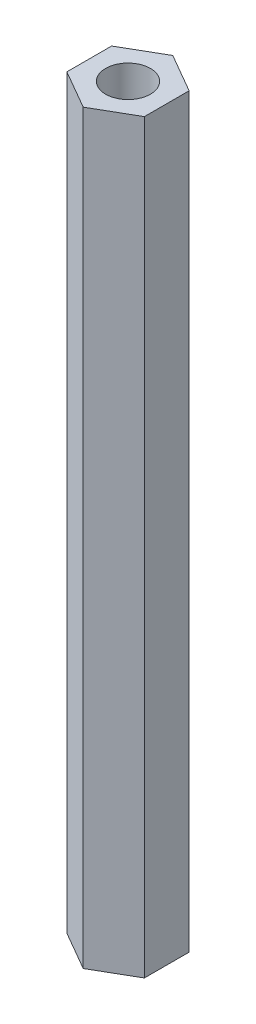
from build123d import *

# Parameters (mm, degrees)
BOSS_EXTRUDE1_DEPTH = 50
SKETCH2_R           = 1.5
CUT_EXTRUDE1_DEPTH  = 51.157252716


with BuildPart() as part:
    # Sketch1 → Boss-Extrude1 (new body)
    with BuildSketch(Plane(origin=(0, 0, 0), x_dir=(1, 0, 0), z_dir=(0, 1, 0))):
        Polygon((0, -3), (2.598076211, -1.5), (2.598076211, 1.5), (0, 3), (-2.598076211, 1.5), (-2.598076211, -1.5), align=None)
    extrude(amount=BOSS_EXTRUDE1_DEPTH)

    # Sketch2 → Cut-Extrude1 (cut, through all)
    with BuildSketch(Plane(origin=(0, 50, 0), x_dir=(1, 0, 0), z_dir=(0, 1, 0))):
        with Locations(Location((0, 0, 0), (0, 0, 270))):
            Circle(SKETCH2_R)
    extrude(amount=-CUT_EXTRUDE1_DEPTH, mode=Mode.SUBTRACT)


solid = part.part
